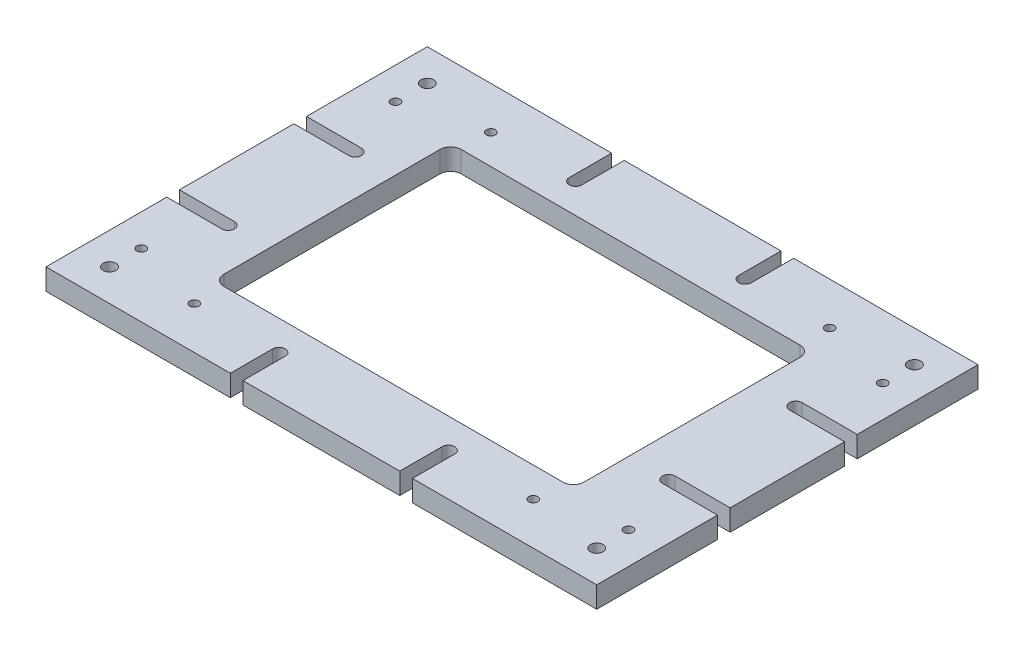
from build123d import *

# Parameters (mm, degrees)
SKETCH1_W              = 165.1
SKETCH1_H              = 114.3
BOSS_EXTRUDE1_DEPTH    = 6.35
F_10_24_TAPPED_HOLE2_D = 3.7973
F_6_32_TAPPED_HOLE2_D  = 2.7051
CUT_EXTRUDE10_DEPTH    = 101.602919938
F_6_32_TAPPED_HOLE1_D  = 2.7051
SKETCH24_W             = 107.95
SKETCH24_H             = 71.12
CUT_EXTRUDE11_DEPTH    = 101.602919938
FILLET1_R              = 3.175


with BuildPart() as part:
    # Sketch1 → Boss-Extrude1 (new body)
    with BuildSketch(Plane(origin=(0, 0, 0), x_dir=(1, 0, 0), z_dir=(0, 1, 0))):
        Rectangle(SKETCH1_W, SKETCH1_H)
    extrude(amount=BOSS_EXTRUDE1_DEPTH)

    # #10-24 Tapped Hole2 (through all)
    with Locations(Plane(origin=(0, 6.35, 0), x_dir=(-1, 0, 0), z_dir=(0, 1, 0))):
        with Locations((73.025, -47.625), (73.025, 47.625), (-73.025, -47.625), (-73.025, 47.625)):
            Hole(F_10_24_TAPPED_HOLE2_D / 2)

    # #6-32 Tapped Hole2 (through all)
    with Locations(Plane(origin=(0, 6.35, 0), x_dir=(-1, 0, 0), z_dir=(0, 1, 0))):
        with Locations((50.8, -44.45), (-50.8, -44.45), (-50.8, 44.45), (50.8, 44.45)):
            Hole(F_6_32_TAPPED_HOLE2_D / 2)

    # Sketch21 → Cut-Extrude10 (cut, through all)
    with BuildSketch(Plane(origin=(0, 6.35, 0), x_dir=(1, 0, 0), z_dir=(0, 1, 0))):
        with BuildLine():
            Line((-82.55, 20.94865), (-66.04, 20.94865))
            ThreePointArc((-66.04, 20.94865), (-64.14135, 19.05), (-66.04, 17.15135))
            Line((-66.04, 17.15135), (-82.55, 17.15135))
            ThreePointArc((-82.55, 17.15135), (-84.44865, 19.05), (-82.55, 20.94865))
        make_face()
        with BuildLine():
            Line((-82.55, -17.15135), (-66.04, -17.15135))
            ThreePointArc((-66.04, -17.15135), (-64.14135, -19.05), (-66.04, -20.94865))
            Line((-66.04, -20.94865), (-82.55, -20.94865))
            ThreePointArc((-82.55, -20.94865), (-84.44865, -19.05), (-82.55, -17.15135))
        make_face()
        with BuildLine():
            Line((-23.50135, 57.15), (-23.50135, 44.45))
            ThreePointArc((-23.50135, 44.45), (-25.4, 42.55135), (-27.29865, 44.45))
            Line((-27.29865, 44.45), (-27.29865, 57.15))
            ThreePointArc((-27.29865, 57.15), (-25.4, 59.04865), (-23.50135, 57.15))
        make_face()
        with BuildLine():
            Line((27.29865, 57.15), (27.29865, 44.45))
            ThreePointArc((27.29865, 44.45), (25.4, 42.55135), (23.50135, 44.45))
            Line((23.50135, 44.45), (23.50135, 57.15))
            ThreePointArc((23.50135, 57.15), (25.4, 59.04865), (27.29865, 57.15))
        make_face()
        with BuildLine():
            Line((66.04, 20.94865), (82.55, 20.94865))
            ThreePointArc((82.55, 20.94865), (84.44865, 19.05), (82.55, 17.15135))
            Line((82.55, 17.15135), (66.04, 17.15135))
            ThreePointArc((66.04, 17.15135), (64.14135, 19.05), (66.04, 20.94865))
        make_face()
        with BuildLine():
            Line((66.04, -17.15135), (82.55, -17.15135))
            ThreePointArc((82.55, -17.15135), (84.44865, -19.05), (82.55, -20.94865))
            Line((82.55, -20.94865), (66.04, -20.94865))
            ThreePointArc((66.04, -20.94865), (64.14135, -19.05), (66.04, -17.15135))
        make_face()
        with BuildLine():
            Line((-27.29865, -57.15), (-27.29865, -44.45))
            ThreePointArc((-27.29865, -44.45), (-25.4, -42.55135), (-23.50135, -44.45))
            Line((-23.50135, -44.45), (-23.50135, -57.15))
            ThreePointArc((-23.50135, -57.15), (-25.4, -59.04865), (-27.29865, -57.15))
        make_face()
        with BuildLine():
            Line((23.50135, -57.15), (23.50135, -44.45))
            ThreePointArc((23.50135, -44.45), (25.4, -42.55135), (27.29865, -44.45))
            Line((27.29865, -44.45), (27.29865, -57.15))
            ThreePointArc((27.29865, -57.15), (25.4, -59.04865), (23.50135, -57.15))
        make_face()
    extrude(amount=-CUT_EXTRUDE10_DEPTH, mode=Mode.SUBTRACT)

    # #6-32 Tapped Hole1 (through all)
    with Locations(Plane(origin=(0, 6.35, 0), x_dir=(-1, 0, 0), z_dir=(0, 1, 0))):
        with Locations((73.025, -38.1), (73.025, 38.1), (-73.025, -38.1), (-73.025, 38.1)):
            Hole(F_6_32_TAPPED_HOLE1_D / 2)

    # Sketch24 → Cut-Extrude11 (cut, through all)
    with BuildSketch(Plane(origin=(0, 6.35, 0), x_dir=(1, 0, 0), z_dir=(0, 1, 0))):
        Rectangle(SKETCH24_W, SKETCH24_H)
    extrude(amount=-CUT_EXTRUDE11_DEPTH, mode=Mode.SUBTRACT)

    # Fillet1
    fillet1_edges = [part.edges().sort_by_distance(p)[0] for p in [
        (-53.975, 3.175, 35.56),
        (-53.975, 3.175, -35.56),
        (53.975, 3.175, -35.56),
        (53.975, 3.175, 35.56),
    ]]
    fillet(fillet1_edges, radius=FILLET1_R)


solid = part.part
